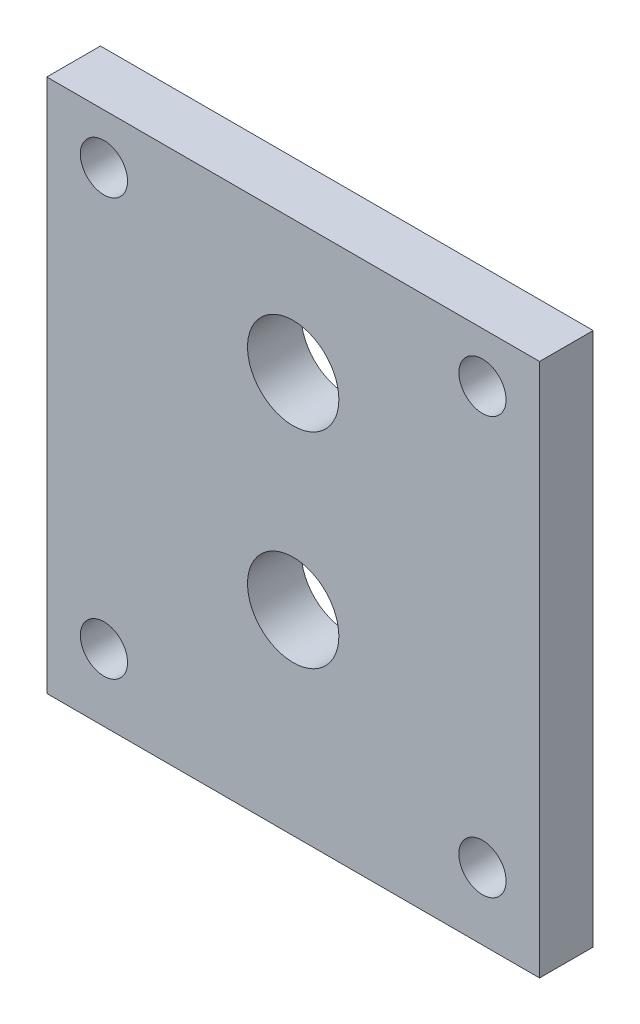
from build123d import *

# Parameters (mm, degrees)
SKETCH1_W           = 29.182779401
SKETCH1_H           = 31.619740081
SKETCH1_R           = 1.397
SKETCH1_R_2         = 2.704093906
BOSS_EXTRUDE1_DEPTH = 3.175


with BuildPart() as part:
    # Sketch1 → Boss-Extrude1 (new body)
    with BuildSketch(Plane.XY):
        with Locations((14.428631608, -13.273961345)):
            Rectangle(SKETCH1_W, SKETCH1_H)
        with Locations((3.220865479, -0.422913296)):
            Circle(SKETCH1_R, mode=Mode.SUBTRACT)
        with Locations((25.636397737, -0.422913296)):
            Circle(SKETCH1_R, mode=Mode.SUBTRACT)
        with Locations((25.636397737, -25.106684096)):
            Circle(SKETCH1_R, mode=Mode.SUBTRACT)
        with Locations((3.220865479, -25.106684096)):
            Circle(SKETCH1_R, mode=Mode.SUBTRACT)
        with Locations((14.428631608, -5.35966738)):
            Circle(SKETCH1_R_2, mode=Mode.SUBTRACT)
        with Locations((14.428631608, -17.501414064)):
            Circle(SKETCH1_R_2, mode=Mode.SUBTRACT)
    extrude(amount=BOSS_EXTRUDE1_DEPTH)


solid = part.part
